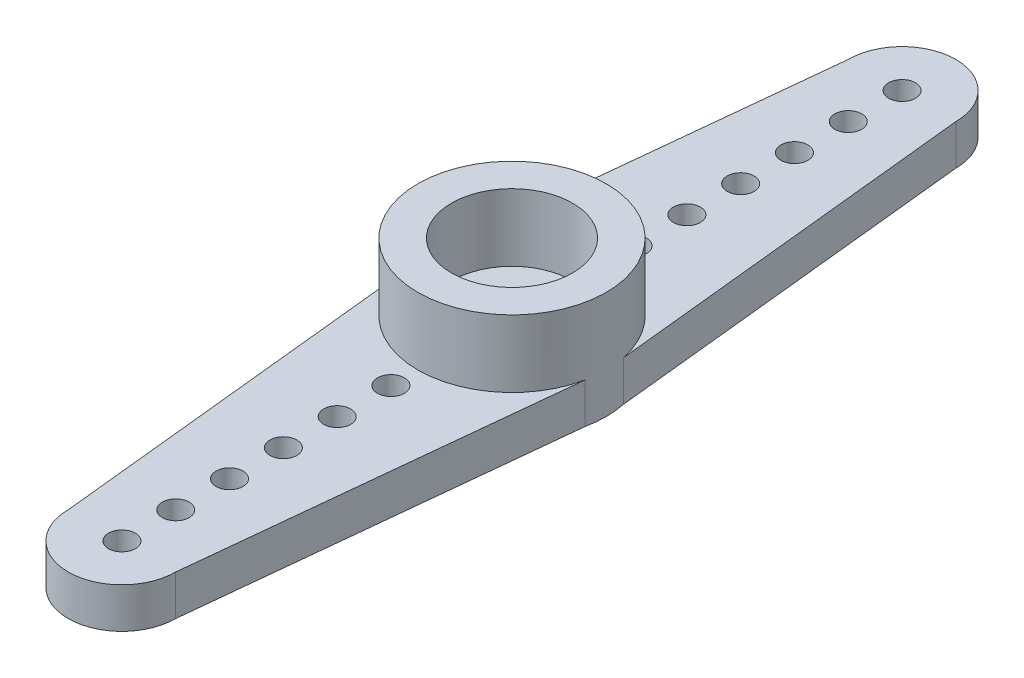
from build123d import *

# Parameters (mm, degrees)
CROQUIS1_R              = 0.5
SALIENTE_EXTRUIR1_DEPTH = 1.5
CROQUIS2_R              = 3.5
CROQUIS2_R_2            = 2.25
SALIENTE_EXTRUIR2_DEPTH = 2.5
CROQUIS3_R              = 2.5
CORTAR_EXTRUIR1_DEPTH   = 1
CROQUIS4_R              = 1
CORTAR_EXTRUIR2_DEPTH   = 1


with BuildPart() as part:
    # Croquis1 → Saliente-Extruir1 (new body)
    with BuildSketch(Plane(origin=(0, 0, 0), x_dir=(1, 0, 0), z_dir=(0, 1, 0))):
        with BuildLine():
            Line((-3.425882353, -0.716470588), (-2, -14.5))
            ThreePointArc((-2, -14.5), (0, -16.5), (2, -14.5))
            Line((2, -14.5), (3.425882353, -0.716470588))
            ThreePointArc((3.425882353, -0.716470588), (3.5, 0), (3.425882353, 0.716470588))
            Line((3.425882353, 0.716470588), (2, 14.5))
            ThreePointArc((2, 14.5), (0, 16.5), (-2, 14.5))
            Line((-2, 14.5), (-3.425882353, 0.716470588))
            ThreePointArc((-3.425882353, 0.716470588), (-3.5, 0), (-3.425882353, -0.716470588))
        make_face()
        with Locations(Location((0, -14.5, 0), (0, 0, 270))):
            Circle(CROQUIS1_R, mode=Mode.SUBTRACT)
        with Locations(Location((0, -12.5, 0), (0, 0, 270))):
            Circle(CROQUIS1_R, mode=Mode.SUBTRACT)
        with Locations(Location((0, -10.5, 0), (0, 0, 270))):
            Circle(CROQUIS1_R, mode=Mode.SUBTRACT)
        with Locations(Location((0, -8.5, 0), (0, 0, 270))):
            Circle(CROQUIS1_R, mode=Mode.SUBTRACT)
        with Locations(Location((0, -6.5, 0), (0, 0, 270))):
            Circle(CROQUIS1_R, mode=Mode.SUBTRACT)
        with Locations(Location((0, -4.5, 0), (0, 0, 270))):
            Circle(CROQUIS1_R, mode=Mode.SUBTRACT)
        with Locations(Location((0, 14.5, 0), (0, 0, 270))):
            Circle(CROQUIS1_R, mode=Mode.SUBTRACT)
        with Locations(Location((0, 12.5, 0), (0, 0, 270))):
            Circle(CROQUIS1_R, mode=Mode.SUBTRACT)
        with Locations(Location((0, 10.5, 0), (0, 0, 270))):
            Circle(CROQUIS1_R, mode=Mode.SUBTRACT)
        with Locations(Location((0, 8.5, 0), (0, 0, 270))):
            Circle(CROQUIS1_R, mode=Mode.SUBTRACT)
        with Locations(Location((0, 6.5, 0), (0, 0, 270))):
            Circle(CROQUIS1_R, mode=Mode.SUBTRACT)
        with Locations(Location((0, 4.5, 0), (0, 0, 270))):
            Circle(CROQUIS1_R, mode=Mode.SUBTRACT)
    extrude(amount=SALIENTE_EXTRUIR1_DEPTH)

    # Croquis2 → Saliente-Extruir2 (add)
    with BuildSketch(Plane(origin=(0, 1.5, 0), x_dir=(1, 0, 0), z_dir=(0, 1, 0))):
        with Locations(Location((0, 0, 0), (0, 0, 11.812282228))):
            Circle(CROQUIS2_R)
        with Locations(Location((0, 0, 0), (0, 0, 270))):
            Circle(CROQUIS2_R_2, mode=Mode.SUBTRACT)
    extrude(amount=SALIENTE_EXTRUIR2_DEPTH)

    # Croquis3 → Cortar-Extruir1 (cut)
    with BuildSketch(Plane.XZ):
        with Locations(Location((0, 0, 0), (0, 0, 270))):
            Circle(CROQUIS3_R)
    extrude(amount=-CORTAR_EXTRUIR1_DEPTH, mode=Mode.SUBTRACT)

    # Croquis4 → Cortar-Extruir2 (cut)
    with BuildSketch(Plane(origin=(0, 1.5, 0), x_dir=(1, 0, 0), z_dir=(0, 1, 0))):
        with Locations(Location((0, 0, 0), (0, 0, 270))):
            Circle(CROQUIS4_R)
    extrude(amount=-CORTAR_EXTRUIR2_DEPTH, mode=Mode.SUBTRACT)


solid = part.part
